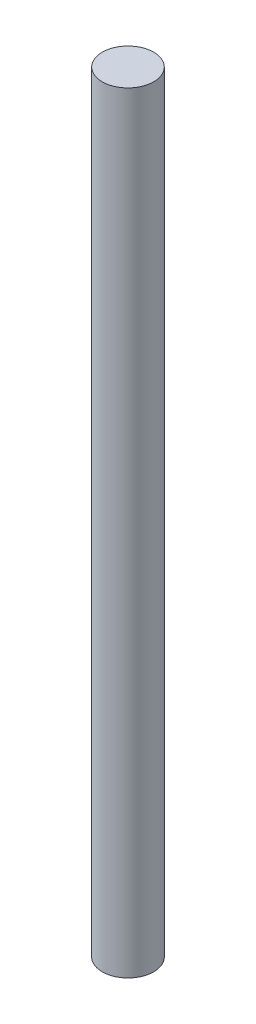
from build123d import *

# Parameters (mm, degrees)
SKETCH1_R           = 4
BOSS_EXTRUDE1_DEPTH = 120


with BuildPart() as part:
    # Sketch1 → Boss-Extrude1 (new body)
    with BuildSketch(Plane(origin=(0, 0, 0), x_dir=(1, 0, 0), z_dir=(0, 1, 0))):
        with Locations(Location((0, 0, 0), (0, 0, 270))):
            Circle(SKETCH1_R)
    extrude(amount=BOSS_EXTRUDE1_DEPTH)


solid = part.part
